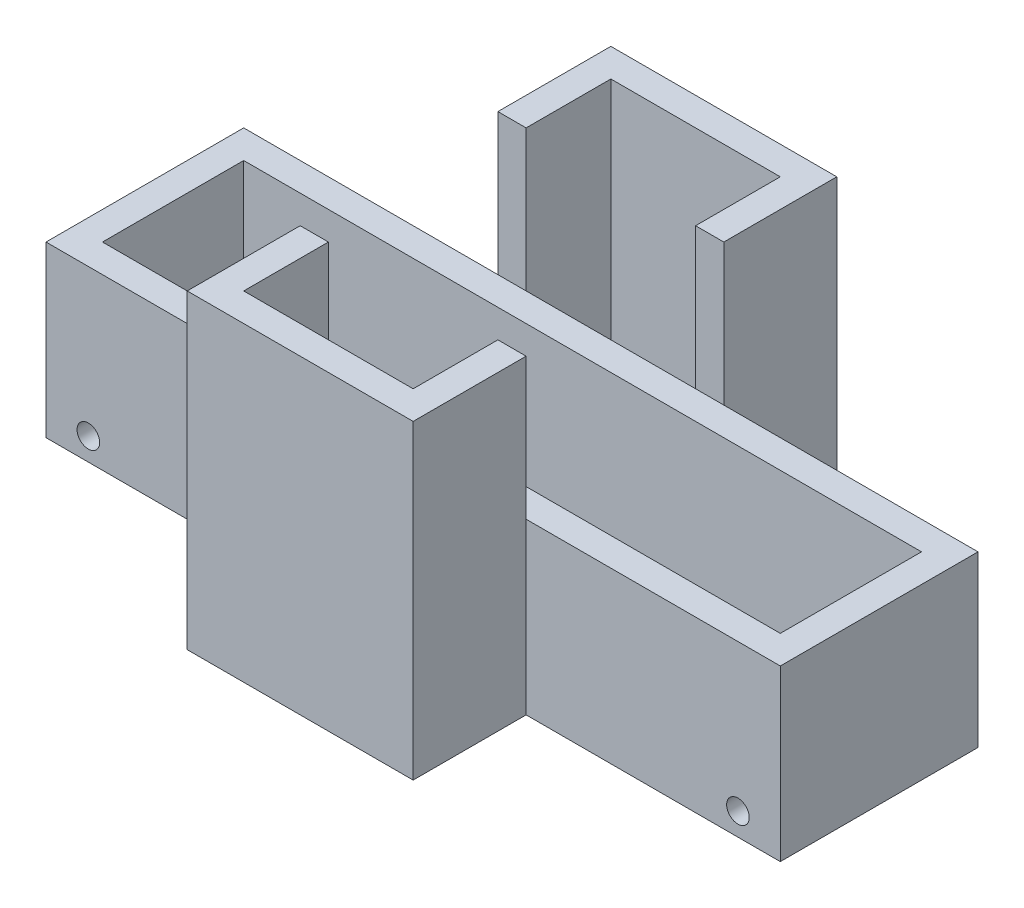
from build123d import *

# Parameters (mm, degrees)
SKETCH1_W           = 130
SKETCH1_H           = 35
BOSS_EXTRUDE1_DEPTH = 30
SKETCH2_W           = 120
SKETCH2_H           = 25
CUT_EXTRUDE1_DEPTH  = 25
SKETCH3_R           = 2
CUT_EXTRUDE2_DEPTH  = 80.686887253
SKETCH4_R           = 2
CUT_EXTRUDE3_DEPTH  = 80.686887253
SKETCH6_W           = 40
SKETCH6_H           = 55
BOSS_EXTRUDE2_DEPTH = 20
SKETCH7_W           = 30
SKETCH7_H           = 15
CUT_EXTRUDE4_DEPTH  = 50
SKETCH8_W           = 40
SKETCH8_H           = 55
BOSS_EXTRUDE3_DEPTH = 20
SKETCH9_W           = 30
SKETCH9_H           = 15
CUT_EXTRUDE5_DEPTH  = 50


with BuildPart() as part:
    # Sketch1 → Boss-Extrude1 (new body)
    with BuildSketch(Plane(origin=(0, 0, 0), x_dir=(1, 0, 0), z_dir=(0, 1, 0))):
        Rectangle(SKETCH1_W, SKETCH1_H)
    extrude(amount=BOSS_EXTRUDE1_DEPTH)

    # Sketch2 → Cut-Extrude1 (cut)
    with BuildSketch(Plane(origin=(0, 30, 0), x_dir=(1, 0, 0), z_dir=(0, 1, 0))):
        Rectangle(SKETCH2_W, SKETCH2_H)
    extrude(amount=-CUT_EXTRUDE1_DEPTH, mode=Mode.SUBTRACT)

    # Sketch3 → Cut-Extrude2 (cut, through all)
    with BuildSketch(Plane.XY.offset(17.5)):
        with Locations((-57.5, 4)):
            Circle(SKETCH3_R)
    extrude(amount=-CUT_EXTRUDE2_DEPTH, mode=Mode.SUBTRACT)

    # Sketch4 → Cut-Extrude3 (cut, through all)
    with BuildSketch(Plane(origin=(0, 0, -17.5), x_dir=(-1, 0, 0), z_dir=(0, 0, -1))):
        with Locations((-57.5, 4)):
            Circle(SKETCH4_R)
    extrude(amount=-CUT_EXTRUDE3_DEPTH, mode=Mode.SUBTRACT)

    # Sketch6 → Boss-Extrude2 (add)
    with BuildSketch(Plane(origin=(0, 0, -17.5), x_dir=(-1, 0, 0), z_dir=(0, 0, -1))):
        with Locations((0, 27.5)):
            Rectangle(SKETCH6_W, SKETCH6_H)
    extrude(amount=BOSS_EXTRUDE2_DEPTH)

    # Sketch7 → Cut-Extrude4 (cut)
    with BuildSketch(Plane(origin=(0, 55, 0), x_dir=(1, 0, 0), z_dir=(0, 1, 0))):
        with Locations((0, 25)):
            Rectangle(SKETCH7_W, SKETCH7_H)
    extrude(amount=-CUT_EXTRUDE4_DEPTH, mode=Mode.SUBTRACT)

    # Sketch8 → Boss-Extrude3 (add)
    with BuildSketch(Plane.XY.offset(17.5)):
        with Locations((0, 27.5)):
            Rectangle(SKETCH8_W, SKETCH8_H)
    extrude(amount=BOSS_EXTRUDE3_DEPTH)

    # Sketch9 → Cut-Extrude5 (cut)
    with BuildSketch(Plane(origin=(0, 55, 0), x_dir=(1, 0, 0), z_dir=(0, 1, 0))):
        with Locations((0, -25)):
            Rectangle(SKETCH9_W, SKETCH9_H)
    extrude(amount=-CUT_EXTRUDE5_DEPTH, mode=Mode.SUBTRACT)


solid = part.part
